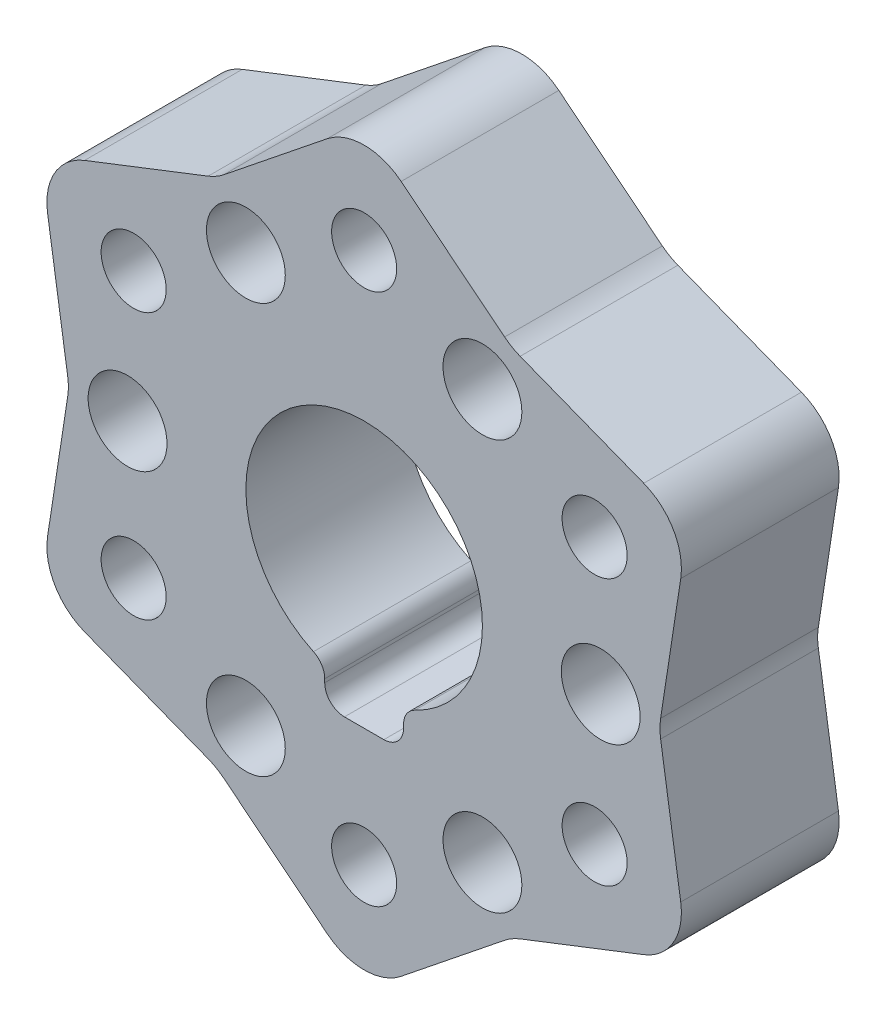
from build123d import *

# Parameters (mm, degrees)
SKETCH_2_R      = 1.65
SKETCH_2_R_2    = 2
EXTRUDE_1_DEPTH = 8
FILLET_1_R      = 3
FILLET_2_R      = 1


with BuildPart() as part:
    # 草图2 → 凸台-拉伸1 (new body)
    with BuildSketch(Plane.XY):
        Polygon((0, 18.963672443), (7.484579775, 12.963672443), (16.423022085, 9.481836222), (14.96915955, 0), (16.423022085, -9.481836222), (7.484579775, -12.963672443), (0, -18.963672443), (-7.484579775, -12.963672443), (-16.423022085, -9.481836222), (-14.96915955, 0), (-16.423022085, 9.481836222), (-7.484579775, 12.963672443), align=None)
        with Locations((0, 13.5)):
            Circle(SKETCH_2_R, mode=Mode.SUBTRACT)
        with Locations((11.691342951, 6.75)):
            Circle(SKETCH_2_R, mode=Mode.SUBTRACT)
        with Locations((11.691342951, -6.75)):
            Circle(SKETCH_2_R, mode=Mode.SUBTRACT)
        with Locations((0, -13.5)):
            Circle(SKETCH_2_R, mode=Mode.SUBTRACT)
        with Locations((-11.691342951, -6.75)):
            Circle(SKETCH_2_R, mode=Mode.SUBTRACT)
        with Locations((-11.691342951, 6.75)):
            Circle(SKETCH_2_R, mode=Mode.SUBTRACT)
        with Locations((6, 10.392304845)):
            Circle(SKETCH_2_R_2, mode=Mode.SUBTRACT)
        with Locations((12, 0)):
            Circle(SKETCH_2_R_2, mode=Mode.SUBTRACT)
        with Locations((6, -10.392304845)):
            Circle(SKETCH_2_R_2, mode=Mode.SUBTRACT)
        with Locations((-6, -10.392304845)):
            Circle(SKETCH_2_R_2, mode=Mode.SUBTRACT)
        with Locations((-12, 0)):
            Circle(SKETCH_2_R_2, mode=Mode.SUBTRACT)
        with Locations((-6, 10.392304845)):
            Circle(SKETCH_2_R_2, mode=Mode.SUBTRACT)
        with BuildLine():
            Line((0, -7.5), (2, -7.5))
            Line((2, -7.5), (2, -5.656854249))
            ThreePointArc((2, -5.656854249), (0, 6), (-2, -5.656854249))
            Line((-2, -5.656854249), (-2, -7.5))
            Line((-2, -7.5), (0, -7.5))
        make_face(mode=Mode.SUBTRACT)
    extrude(amount=EXTRUDE_1_DEPTH)

    # 圆角1
    fillet_1_edges = [part.edges().sort_by_distance(p)[0] for p in [
        (0, 18.963672443, 4),
        (7.484579775, 12.963672443, 4),
        (16.423022085, 9.481836222, 4),
        (14.96915955, 0, 4),
        (16.423022085, -9.481836222, 4),
        (7.484579775, -12.963672443, 4),
        (0, -18.963672443, 4),
        (-7.484579775, -12.963672443, 4),
        (-16.423022085, -9.481836222, 4),
        (-14.96915955, 0, 4),
        (-16.423022085, 9.481836222, 4),
        (-7.484579775, 12.963672443, 4),
    ]]
    fillet(fillet_1_edges, radius=FILLET_1_R)

    # 圆角2
    fillet_2_edges = [part.edges().sort_by_distance(p)[0] for p in [
        (-2, -7.5, 4),
        (2, -7.5, 4),
        (2, -5.656854249, 4),
        (-2, -5.656854249, 4),
    ]]
    fillet(fillet_2_edges, radius=FILLET_2_R)


solid = part.part
